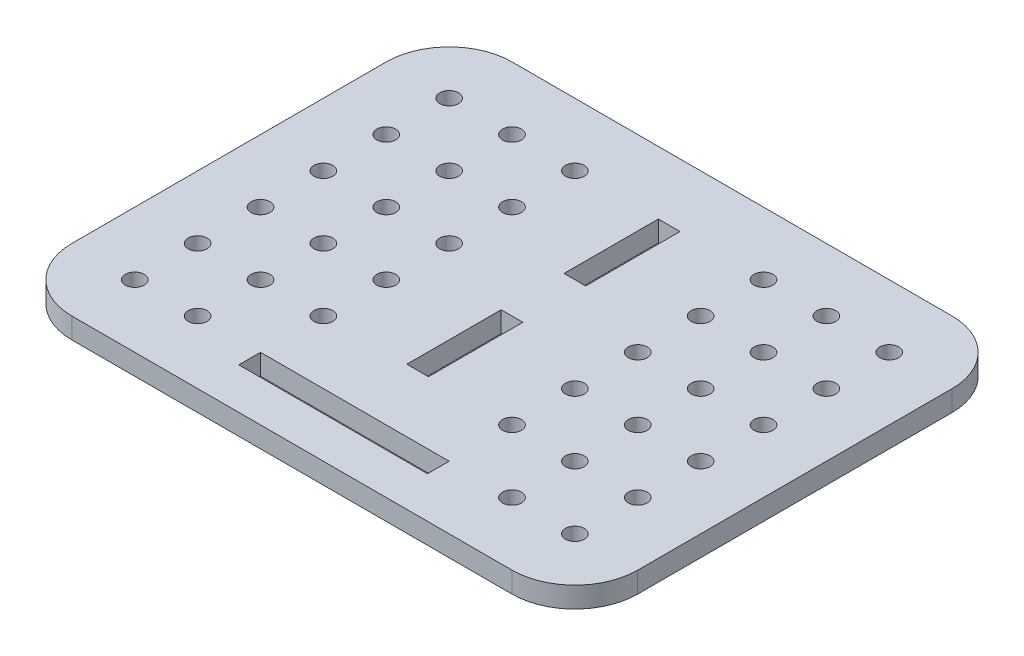
from build123d import *

# Parameters (mm, degrees)
SKETCH1_R           = 1.5
SKETCH1_W           = 3.45
SKETCH1_H           = 15
SKETCH1_W_2         = 30
SKETCH1_H_2         = 3.45
BOSS_EXTRUDE1_DEPTH = 3.3


with BuildPart() as part:
    # Sketch1 → Boss-Extrude1 (new body)
    with BuildSketch(Plane(origin=(0, 0, 0), x_dir=(1, 0, 0), z_dir=(0, 1, 0))):
        with BuildLine():
            Line((-35, 35), (35, 35))
            ThreePointArc((35, 35), (42.071067812, 32.071067812), (45, 25))
            Line((45, 25), (45, -25))
            ThreePointArc((45, -25), (42.071067812, -32.071067812), (35, -35))
            Line((35, -35), (-35, -35))
            ThreePointArc((-35, -35), (-42.071067812, -32.071067812), (-45, -25))
            Line((-45, -25), (-45, 25))
            ThreePointArc((-45, 25), (-42.071067812, 32.071067812), (-35, 35))
        make_face()
        with Locations(Location((-35, -25, 0), (0, 0, 270))):
            Circle(SKETCH1_R, mode=Mode.SUBTRACT)
        with Locations(Location((-35, -15, 0), (0, 0, 270))):
            Circle(SKETCH1_R, mode=Mode.SUBTRACT)
        with Locations(Location((-35, -5, 0), (0, 0, 270))):
            Circle(SKETCH1_R, mode=Mode.SUBTRACT)
        with Locations(Location((-35, 5, 0), (0, 0, 270))):
            Circle(SKETCH1_R, mode=Mode.SUBTRACT)
        with Locations(Location((-35, 15, 0), (0, 0, 270))):
            Circle(SKETCH1_R, mode=Mode.SUBTRACT)
        with Locations(Location((-35, 25, 0), (0, 0, 270))):
            Circle(SKETCH1_R, mode=Mode.SUBTRACT)
        with Locations(Location((-25, -25, 0), (0, 0, 270))):
            Circle(SKETCH1_R, mode=Mode.SUBTRACT)
        with Locations(Location((-25, -15, 0), (0, 0, 270))):
            Circle(SKETCH1_R, mode=Mode.SUBTRACT)
        with Locations(Location((-25, -5, 0), (0, 0, 270))):
            Circle(SKETCH1_R, mode=Mode.SUBTRACT)
        with Locations(Location((-25, 5, 0), (0, 0, 270))):
            Circle(SKETCH1_R, mode=Mode.SUBTRACT)
        with Locations(Location((-25, 15, 0), (0, 0, 270))):
            Circle(SKETCH1_R, mode=Mode.SUBTRACT)
        with Locations(Location((-25, 25, 0), (0, 0, 270))):
            Circle(SKETCH1_R, mode=Mode.SUBTRACT)
        with Locations(Location((-15, -15, 0), (0, 0, 270))):
            Circle(SKETCH1_R, mode=Mode.SUBTRACT)
        with Locations(Location((-15, -5, 0), (0, 0, 270))):
            Circle(SKETCH1_R, mode=Mode.SUBTRACT)
        with Locations(Location((-15, 5, 0), (0, 0, 270))):
            Circle(SKETCH1_R, mode=Mode.SUBTRACT)
        with Locations(Location((-15, 15, 0), (0, 0, 270))):
            Circle(SKETCH1_R, mode=Mode.SUBTRACT)
        with Locations(Location((-15, 25, 0), (0, 0, 270))):
            Circle(SKETCH1_R, mode=Mode.SUBTRACT)
        with Locations(Location((15, -15, 0), (0, 0, 270))):
            Circle(SKETCH1_R, mode=Mode.SUBTRACT)
        with Locations(Location((15, -5, 0), (0, 0, 270))):
            Circle(SKETCH1_R, mode=Mode.SUBTRACT)
        with Locations(Location((15, 5, 0), (0, 0, 270))):
            Circle(SKETCH1_R, mode=Mode.SUBTRACT)
        with Locations(Location((15, 15, 0), (0, 0, 270))):
            Circle(SKETCH1_R, mode=Mode.SUBTRACT)
        with Locations(Location((15, 25, 0), (0, 0, 270))):
            Circle(SKETCH1_R, mode=Mode.SUBTRACT)
        with Locations(Location((25, -25, 0), (0, 0, 270))):
            Circle(SKETCH1_R, mode=Mode.SUBTRACT)
        with Locations(Location((25, -15, 0), (0, 0, 270))):
            Circle(SKETCH1_R, mode=Mode.SUBTRACT)
        with Locations(Location((25, -5, 0), (0, 0, 270))):
            Circle(SKETCH1_R, mode=Mode.SUBTRACT)
        with Locations(Location((25, 5, 0), (0, 0, 270))):
            Circle(SKETCH1_R, mode=Mode.SUBTRACT)
        with Locations(Location((25, 15, 0), (0, 0, 270))):
            Circle(SKETCH1_R, mode=Mode.SUBTRACT)
        with Locations(Location((25, 25, 0), (0, 0, 270))):
            Circle(SKETCH1_R, mode=Mode.SUBTRACT)
        with Locations(Location((35, -25, 0), (0, 0, 270))):
            Circle(SKETCH1_R, mode=Mode.SUBTRACT)
        with Locations(Location((35, -15, 0), (0, 0, 270))):
            Circle(SKETCH1_R, mode=Mode.SUBTRACT)
        with Locations(Location((35, -5, 0), (0, 0, 270))):
            Circle(SKETCH1_R, mode=Mode.SUBTRACT)
        with Locations(Location((35, 5, 0), (0, 0, 270))):
            Circle(SKETCH1_R, mode=Mode.SUBTRACT)
        with Locations(Location((35, 15, 0), (0, 0, 270))):
            Circle(SKETCH1_R, mode=Mode.SUBTRACT)
        with Locations(Location((35, 25, 0), (0, 0, 270))):
            Circle(SKETCH1_R, mode=Mode.SUBTRACT)
        with Locations((0, -7.5)):
            Rectangle(SKETCH1_W, SKETCH1_H, mode=Mode.SUBTRACT)
        with Locations((0, 17.5)):
            Rectangle(SKETCH1_W, SKETCH1_H, mode=Mode.SUBTRACT)
        with Locations((0, -26.725)):
            Rectangle(SKETCH1_W_2, SKETCH1_H_2, mode=Mode.SUBTRACT)
    extrude(amount=BOSS_EXTRUDE1_DEPTH)


solid = part.part
